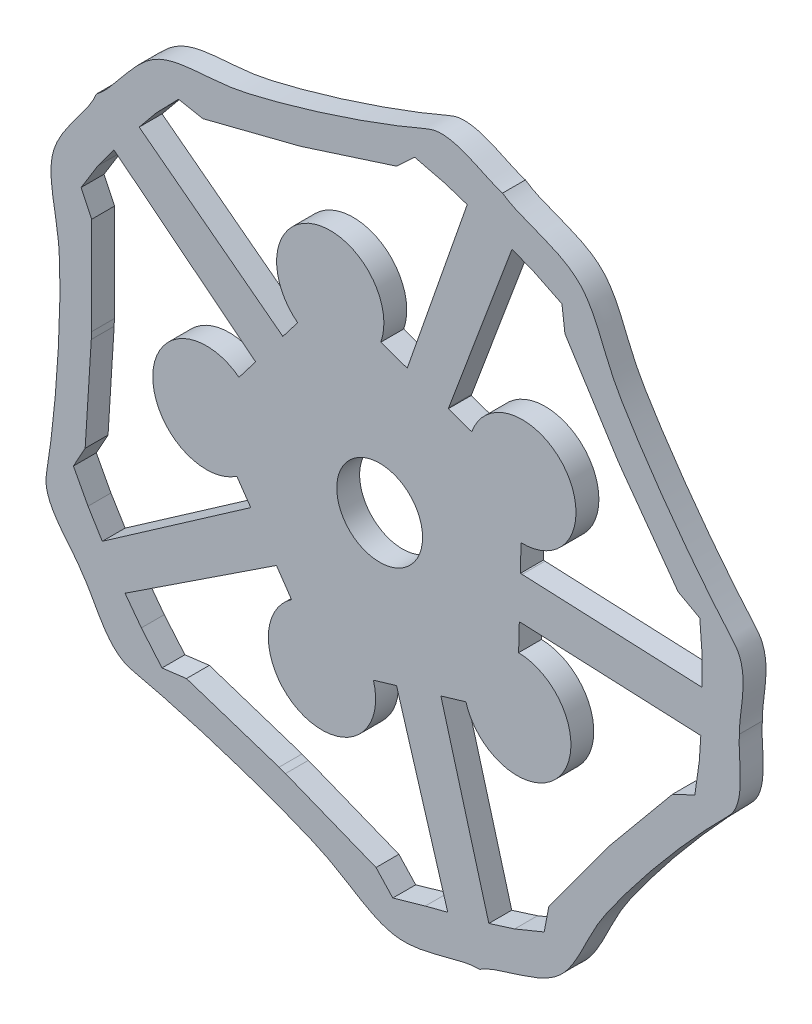
from build123d import *

# Parameters (mm, degrees)
SKETCH1_R           = 3
BOSS_EXTRUDE1_DEPTH = 1.6


with BuildPart() as part:
    # Sketch1 → Boss-Extrude1 (new body)
    with BuildSketch(Plane.XY):
        with BuildLine():
            add(Edge.make_bspline(
                [(-19.803359715, 15.453419311), (-18.405947529, 16.480598176), (-16.865662186, 19.732795688), (-13.080130181, 20.35145444), (-10.552712302, 20.453881039), (-7.10879258, 21.264944161), (-2.653848069, 22.580943494), (1.471145086, 24.09546527), (5.038822654, 25.670890535), (7.324131038, 23.998569775), (8.591411433, 23.647907344)],
                knots=[0, 0, 0, 0, 0.190521612, 0.271147793, 0.35187009, 0.432694495, 0.605069532, 0.800340174, 0.829757563, 1, 1, 1, 1], degree=3))
            add(Edge.make_bspline(
                [(-19.803359715, 15.453419311), (-20.456487654, 13.846782721), (-23.231656968, 11.555996203), (-22.903102354, 7.734341708), (-22.382604891, 5.258980172), (-22.324352891, 1.721323724), (-22.507686222, -2.920311088), (-22.964393827, -7.290753046), (-23.616815258, -11.135832274), (-21.435134382, -12.941257344), (-20.78440531, -14.083848879)],
                knots=[0, 0, 0, 0, 0.190521612, 0.271147793, 0.35187009, 0.432694495, 0.605069532, 0.800340174, 0.829757563, 1, 1, 1, 1], degree=3))
            add(Edge.make_bspline(
                [(7.004046315, -24.144396523), (5.269755521, -24.154023407), (2.112044767, -25.879749455), (-1.314153448, -24.155175014), (-3.419082308, -22.752460918), (-6.682002832, -21.384339544), (-11.059653651, -19.830454685), (-15.287056779, -18.631118398), (-19.099380299, -17.808635952), (-19.965268139, -15.112429472), (-20.78440531, -14.083848879)],
                knots=[0, 0, 0, 0, 0.190521612, 0.271147793, 0.35187009, 0.432694495, 0.605069532, 0.800340174, 0.829757563, 1, 1, 1, 1], degree=3))
            add(Edge.make_bspline(
                [(7.004046315, -24.144396523), (8.476795211, -23.228499189), (12.06844488, -23.006417561), (14.048950766, -19.721514571), (15.082840477, -17.412964288), (17.115095907, -14.516700435), (19.991700177, -10.869299619), (22.93006572, -7.601983797), (25.717966609, -4.874733052), (25.014151934, -2.131753644), (25.15929951, -0.824888722)],
                knots=[0, 0, 0, 0, 0.190521612, 0.271147793, 0.35187009, 0.432694495, 0.605069532, 0.800340174, 0.829757563, 1, 1, 1, 1], degree=3))
            add(Edge.make_bspline(
                [(8.591411433, 23.647907344), (10.000140699, 22.636305104), (13.569138682, 22.176390993), (15.327311842, 18.767312179), (16.205740403, 16.395246496), (18.041336991, 13.370516491), (20.669580295, 9.540278642), (23.384669086, 6.085189989), (25.985460549, 3.17896017), (25.101188121, 0.488727206), (25.15929951, -0.824888722)],
                knots=[0, 0, 0, 0, 0.190521612, 0.271147793, 0.35187009, 0.432694495, 0.605069532, 0.800340174, 0.829757563, 1, 1, 1, 1], degree=3))
        make_face()
        with BuildLine():
            Line((-17.801162623, -13.775916995), (-7.288377194, -6.849035991))
            Line((-7.288377194, -6.849035991), (-7.219097449, -6.80130634))
            Line((-7.219097449, -6.80130634), (-6.159615012, -8.339148545))
            ThreePointArc((-6.159615012, -8.339148545), (-5.27990407, -14.963540508), (-0.437739512, -10.358119505))
            Line((-0.437739512, -10.358119505), (1.180640518, -9.876749677))
            Line((1.180640518, -9.876749677), (4.761279199, -21.814031949))
            Line((4.761279199, -21.814031949), (3.192860098, -22.21819377))
            Line((3.192860098, -22.21819377), (0.919751527, -22.870102125))
            Line((0.919751527, -22.870102125), (-0.254910052, -21.60919454))
            Line((-0.254910052, -21.60919454), (-6.586009521, -19.087490005))
            Line((-6.586009521, -19.087490005), (-7.033888934, -18.924819298))
            Line((-7.033888934, -18.924819298), (-13.507608069, -16.79578787))
            Line((-13.507608069, -16.79578787), (-15.217659106, -17.00896201))
            Line((-15.217659106, -17.00896201), (-16.659623067, -15.304131809))
            Line((-16.659623067, -15.304131809), (-17.801162623, -13.775916995))
        make_face(mode=Mode.SUBTRACT)
        with BuildLine():
            Line((7.634790842, -21.052282346), (4.280200388, -8.954818752))
            Line((4.280200388, -8.954818752), (6.027575847, -8.435080614))
            ThreePointArc((6.027575847, -8.435080614), (12.599592621, -9.645475484), (9.715888103, -3.617149972))
            Line((9.715888103, -3.617149972), (9.763492876, -1.717414351))
            Line((9.763492876, -1.717414351), (9.866614215, -1.717414351))
            Line((9.866614215, -1.717414351), (22.45361097, -2.264716527))
            Line((22.45361097, -2.264716527), (22.348565614, -3.865907691))
            Line((22.348565614, -3.865907691), (22.036670653, -6.076886573))
            Line((22.036670653, -6.076886573), (20.475982717, -6.807619719))
            Line((20.475982717, -6.807619719), (16.132052278, -12.058532267))
            Line((16.132052278, -12.058532267), (15.839712763, -12.434823824))
            Line((15.839712763, -12.434823824), (11.825691605, -17.942041668))
            Line((11.825691605, -17.942041668), (11.503472084, -19.634936333))
            Line((11.503472084, -19.634936333), (9.438229008, -20.483745566))
            Line((9.438229008, -20.483745566), (7.634790842, -21.052282346))
        make_face(mode=Mode.SUBTRACT)
        with BuildLine():
            Line((-9.013454275, -4.196791566), (-9.062625773, -4.230667824))
            Line((-9.062625773, -4.230667824), (-19.392672935, -11.42722697))
            Line((-19.392672935, -11.42722697), (-20.388928576, -9.800565427))
            Line((-20.388928576, -9.800565427), (-21.411625147, -7.878730903))
            Line((-21.411625147, -7.878730903), (-20.590871671, -6.392578193))
            Line((-20.590871671, -6.392578193), (-20.16296708, 0.408797543))
            Line((-20.16296708, 0.408797543), (-20.147638072, 0.885056663))
            Line((-20.147638072, 0.885056663), (-20.137288169, 7.699871931))
            Line((-20.137288169, 7.699871931), (-20.871665619, 9.258848366))
            Line((-20.871665619, 9.258848366), (-19.699766422, 11.159468884))
            Line((-19.699766422, 11.159468884), (-18.574931832, 12.679459157))
            Line((-18.574931832, 12.679459157), (-8.722336792, 4.841939849))
            Line((-8.722336792, 4.841939849), (-8.670186056, 4.802016443))
            Line((-8.670186056, 4.802016443), (-9.834427282, 3.281203376))
            ThreePointArc((-9.834427282, 3.281203376), (-15.862752793, 0.397498858), (-9.986426, -2.784519941))
            Line((-9.986426, -2.784519941), (-9.013454275, -4.196791566))
        make_face(mode=Mode.SUBTRACT)
        Circle(SKETCH1_R, mode=Mode.SUBTRACT)
        with BuildLine():
            Line((6.121522806, 21.717593523), (1.967710182, 9.833109359))
            Line((1.967710182, 9.833109359), (1.926422403, 9.716097508))
            Line((1.926422403, 9.716097508), (0.081604692, 10.367043755))
            ThreePointArc((0.081604692, 10.367043755), (-4.523816312, 15.209208313), (-5.734211182, 8.637191539))
            Line((-5.734211182, 8.637191539), (-6.766621458, 7.288585249))
            Line((-6.766621458, 7.288585249), (-6.798510611, 7.312997629))
            Line((-6.798510611, 7.312997629), (-16.812855722, 14.94275712))
            Line((-16.812855722, 14.94275712), (-15.615120331, 16.405990943))
            Line((-15.615120331, 16.405990943), (-14.059918796, 18.008193884))
            Line((-14.059918796, 18.008193884), (-12.368454733, 17.678546972))
            Line((-12.368454733, 17.678546972), (-5.764266933, 19.359772047))
            Line((-5.764266933, 19.359772047), (-5.306309433, 19.491425595))
            Line((-5.306309433, 19.491425595), (1.182452638, 21.574159623))
            Line((1.182452638, 21.574159623), (2.440612373, 22.751763906))
            Line((2.440612373, 22.751763906), (4.609259773, 22.220092452))
            Line((4.609259773, 22.220092452), (6.121522806, 21.717593523))
        make_face(mode=Mode.SUBTRACT)
        with BuildLine():
            Line((22.534987607, 0.697240391), (9.957292517, 1.246716644))
            Line((9.957292517, 1.246716644), (9.837769938, 1.246716644))
            Line((9.837769938, 1.246716644), (9.884861755, 3.125982028))
            ThreePointArc((9.884861755, 3.125982028), (13.066880554, 9.002308821), (6.442488591, 8.122597879))
            Line((6.442488591, 8.122597879), (4.803089909, 8.701061764))
            Line((4.803089909, 8.701061764), (4.836106759, 8.794633347))
            Line((4.836106759, 8.794633347), (9.253126228, 20.583825947))
            Line((9.253126228, 20.583825947), (10.736580456, 20.001753607))
            Line((10.736580456, 20.001753607), (12.742965485, 19.021893824))
            Line((12.742965485, 19.021893824), (12.95565491, 17.311782432))
            Line((12.95565491, 17.311782432), (16.607221178, 11.557837868))
            Line((16.607221178, 11.557837868), (16.874757837, 11.163525981))
            Line((16.874757837, 11.163525981), (20.872032501, 5.644141096))
            Line((20.872032501, 5.644141096), (22.382499695, 4.814558901))
            Line((22.382499695, 4.814558901), (22.55157004, 2.588099537))
            Line((22.55157004, 2.588099537), (22.534987607, 0.697240391))
        make_face(mode=Mode.SUBTRACT)
    extrude(amount=BOSS_EXTRUDE1_DEPTH)


solid = part.part
